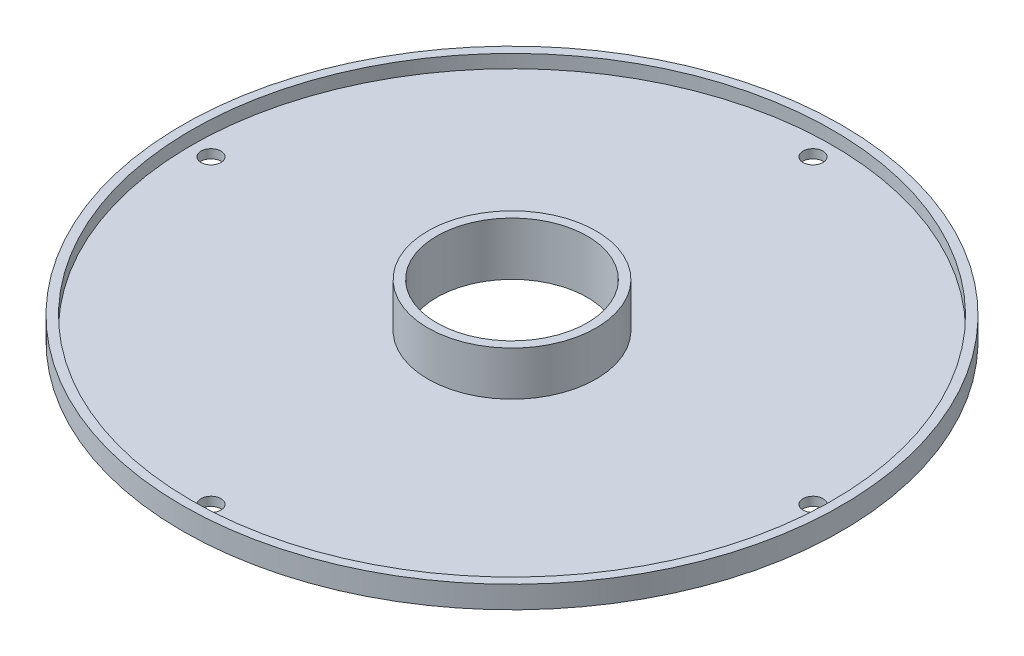
from build123d import *

# Parameters (mm, degrees)
SKETCH1_R           = 74.45
SKETCH1_R_2         = 2.25
SKETCH1_R_3         = 17
BOSS_EXTRUDE1_DEPTH = 2
SKETCH2_R           = 19
SKETCH2_R_2         = 17
BOSS_EXTRUDE2_DEPTH = 10
SKETCH3_R           = 74.45
SKETCH3_R_2         = 72.45
BOSS_EXTRUDE3_DEPTH = 3


with BuildPart() as part:
    # Sketch1 → Boss-Extrude1 (new body)
    with BuildSketch(Plane(origin=(0, 0, 0), x_dir=(1, 0, 0), z_dir=(0, 1, 0))):
        with Locations(Location((0, 0, 0), (0, 0, 270))):
            Circle(SKETCH1_R)
        with Locations(Location((68, 0, 0), (0, 0, 270))):
            Circle(SKETCH1_R_2, mode=Mode.SUBTRACT)
        with Locations(Location((0, -68, 0), (0, 0, 270))):
            Circle(SKETCH1_R_2, mode=Mode.SUBTRACT)
        with Locations(Location((-68, 0, 0), (0, 0, 270))):
            Circle(SKETCH1_R_2, mode=Mode.SUBTRACT)
        with Locations(Location((0, 68, 0), (0, 0, 270))):
            Circle(SKETCH1_R_2, mode=Mode.SUBTRACT)
        with Locations(Location((0, 0, 0), (0, 0, 270))):
            Circle(SKETCH1_R_3, mode=Mode.SUBTRACT)
    extrude(amount=BOSS_EXTRUDE1_DEPTH)

    # Sketch2 → Boss-Extrude2 (add)
    with BuildSketch(Plane(origin=(0, 2, 0), x_dir=(1, 0, 0), z_dir=(0, 1, 0))):
        with Locations(Location((0, 0, 0), (0, 0, 270))):
            Circle(SKETCH2_R)
        with Locations(Location((0, 0, 0), (0, 0, 270))):
            Circle(SKETCH2_R_2, mode=Mode.SUBTRACT)
    extrude(amount=BOSS_EXTRUDE2_DEPTH)

    # Sketch3 → Boss-Extrude3 (add)
    with BuildSketch(Plane(origin=(0, 2, 0), x_dir=(1, 0, 0), z_dir=(0, 1, 0))):
        with Locations(Location((0, 0, 0), (0, 0, 270))):
            Circle(SKETCH3_R)
        with Locations(Location((0, 0, 0), (0, 0, 270))):
            Circle(SKETCH3_R_2, mode=Mode.SUBTRACT)
    extrude(amount=BOSS_EXTRUDE3_DEPTH)


solid = part.part
